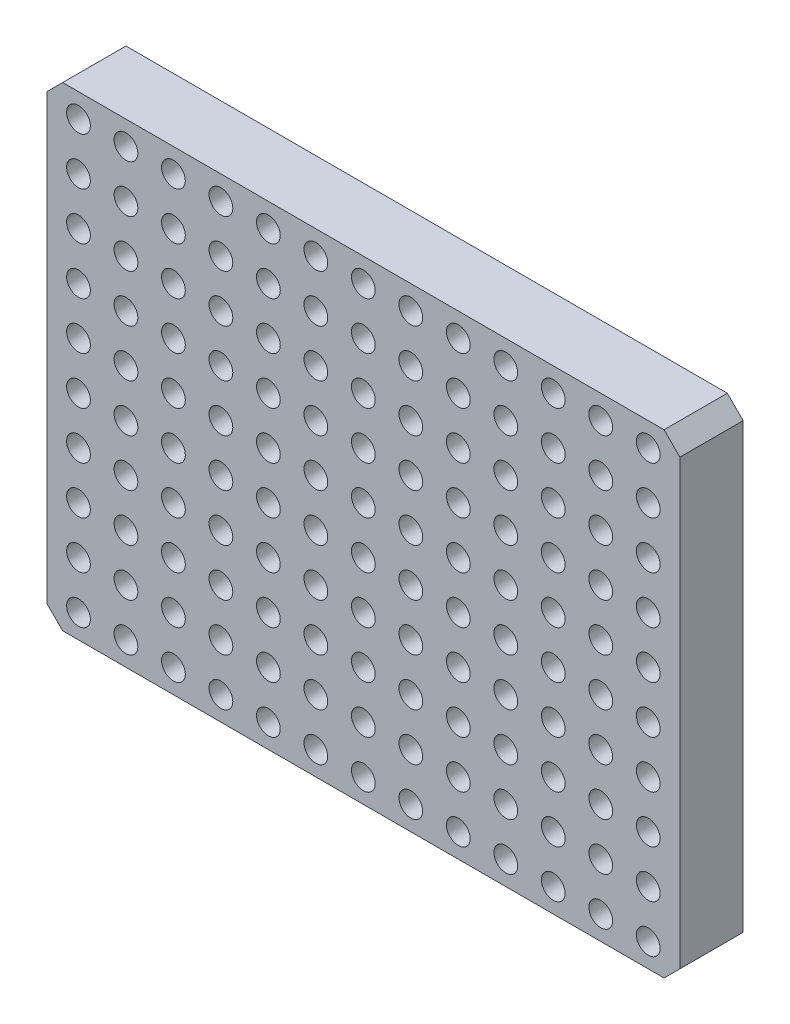
from build123d import *

# Parameters (mm, degrees)
SKETCH_1_W          = 400
SKETCH_1_H          = 300
EXTRUDE_1_DEPTH     = 40
SKETCH_2_R          = 7.5
CUT_EXTRUDE_1_DEPTH = 20
CHAMFER_1_SIZE      = 10


with BuildPart() as part:
    # 草图1 → 凸台-拉伸1 (new body)
    with BuildSketch(Plane.XY):
        Rectangle(SKETCH_1_W, SKETCH_1_H)
    extrude(amount=EXTRUDE_1_DEPTH)

    # 草图2 → 切除-拉伸1 (cut)
    with BuildSketch(Plane.XY.offset(40)):
        with Locations((-180, 135)):
            Circle(SKETCH_2_R)
        with Locations((-150, 135)):
            Circle(SKETCH_2_R)
        with Locations((-120, 135)):
            Circle(SKETCH_2_R)
        with Locations((-90, 135)):
            Circle(SKETCH_2_R)
        with Locations((-60, 135)):
            Circle(SKETCH_2_R)
        with Locations((-30, 135)):
            Circle(SKETCH_2_R)
        with Locations((0, 135)):
            Circle(SKETCH_2_R)
        with Locations((30, 135)):
            Circle(SKETCH_2_R)
        with Locations((60, 135)):
            Circle(SKETCH_2_R)
        with Locations((90, 135)):
            Circle(SKETCH_2_R)
        with Locations((120, 135)):
            Circle(SKETCH_2_R)
        with Locations((150, 135)):
            Circle(SKETCH_2_R)
        with Locations((180, 135)):
            Circle(SKETCH_2_R)
        with Locations((-150, 105)):
            Circle(SKETCH_2_R)
        with Locations((-120, 105)):
            Circle(SKETCH_2_R)
        with Locations((-90, 105)):
            Circle(SKETCH_2_R)
        with Locations((-60, 105)):
            Circle(SKETCH_2_R)
        with Locations((-30, 105)):
            Circle(SKETCH_2_R)
        with Locations((0, 105)):
            Circle(SKETCH_2_R)
        with Locations((30, 105)):
            Circle(SKETCH_2_R)
        with Locations((60, 105)):
            Circle(SKETCH_2_R)
        with Locations((90, 105)):
            Circle(SKETCH_2_R)
        with Locations((120, 105)):
            Circle(SKETCH_2_R)
        with Locations((150, 105)):
            Circle(SKETCH_2_R)
        with Locations((180, 105)):
            Circle(SKETCH_2_R)
        with Locations((-150, 75)):
            Circle(SKETCH_2_R)
        with Locations((-120, 75)):
            Circle(SKETCH_2_R)
        with Locations((-90, 75)):
            Circle(SKETCH_2_R)
        with Locations((-60, 75)):
            Circle(SKETCH_2_R)
        with Locations((-30, 75)):
            Circle(SKETCH_2_R)
        with Locations((0, 75)):
            Circle(SKETCH_2_R)
        with Locations((30, 75)):
            Circle(SKETCH_2_R)
        with Locations((60, 75)):
            Circle(SKETCH_2_R)
        with Locations((90, 75)):
            Circle(SKETCH_2_R)
        with Locations((120, 75)):
            Circle(SKETCH_2_R)
        with Locations((150, 75)):
            Circle(SKETCH_2_R)
        with Locations((180, 75)):
            Circle(SKETCH_2_R)
        with Locations((-150, 45)):
            Circle(SKETCH_2_R)
        with Locations((-120, 45)):
            Circle(SKETCH_2_R)
        with Locations((-90, 45)):
            Circle(SKETCH_2_R)
        with Locations((-60, 45)):
            Circle(SKETCH_2_R)
        with Locations((-30, 45)):
            Circle(SKETCH_2_R)
        with Locations((0, 45)):
            Circle(SKETCH_2_R)
        with Locations((30, 45)):
            Circle(SKETCH_2_R)
        with Locations((60, 45)):
            Circle(SKETCH_2_R)
        with Locations((90, 45)):
            Circle(SKETCH_2_R)
        with Locations((120, 45)):
            Circle(SKETCH_2_R)
        with Locations((150, 45)):
            Circle(SKETCH_2_R)
        with Locations((180, 45)):
            Circle(SKETCH_2_R)
        with Locations((-150, 15)):
            Circle(SKETCH_2_R)
        with Locations((-120, 15)):
            Circle(SKETCH_2_R)
        with Locations((-90, 15)):
            Circle(SKETCH_2_R)
        with Locations((-60, 15)):
            Circle(SKETCH_2_R)
        with Locations((-30, 15)):
            Circle(SKETCH_2_R)
        with Locations((0, 15)):
            Circle(SKETCH_2_R)
        with Locations((30, 15)):
            Circle(SKETCH_2_R)
        with Locations((60, 15)):
            Circle(SKETCH_2_R)
        with Locations((90, 15)):
            Circle(SKETCH_2_R)
        with Locations((120, 15)):
            Circle(SKETCH_2_R)
        with Locations((150, 15)):
            Circle(SKETCH_2_R)
        with Locations((180, 15)):
            Circle(SKETCH_2_R)
        with Locations((-150, -15)):
            Circle(SKETCH_2_R)
        with Locations((-120, -15)):
            Circle(SKETCH_2_R)
        with Locations((-90, -15)):
            Circle(SKETCH_2_R)
        with Locations((-60, -15)):
            Circle(SKETCH_2_R)
        with Locations((-30, -15)):
            Circle(SKETCH_2_R)
        with Locations((0, -15)):
            Circle(SKETCH_2_R)
        with Locations((30, -15)):
            Circle(SKETCH_2_R)
        with Locations((60, -15)):
            Circle(SKETCH_2_R)
        with Locations((90, -15)):
            Circle(SKETCH_2_R)
        with Locations((120, -15)):
            Circle(SKETCH_2_R)
        with Locations((150, -15)):
            Circle(SKETCH_2_R)
        with Locations((180, -15)):
            Circle(SKETCH_2_R)
        with Locations((-150, -45)):
            Circle(SKETCH_2_R)
        with Locations((-120, -45)):
            Circle(SKETCH_2_R)
        with Locations((-90, -45)):
            Circle(SKETCH_2_R)
        with Locations((-60, -45)):
            Circle(SKETCH_2_R)
        with Locations((-30, -45)):
            Circle(SKETCH_2_R)
        with Locations((0, -45)):
            Circle(SKETCH_2_R)
        with Locations((30, -45)):
            Circle(SKETCH_2_R)
        with Locations((60, -45)):
            Circle(SKETCH_2_R)
        with Locations((90, -45)):
            Circle(SKETCH_2_R)
        with Locations((120, -45)):
            Circle(SKETCH_2_R)
        with Locations((150, -45)):
            Circle(SKETCH_2_R)
        with Locations((180, -45)):
            Circle(SKETCH_2_R)
        with Locations((-150, -75)):
            Circle(SKETCH_2_R)
        with Locations((-120, -75)):
            Circle(SKETCH_2_R)
        with Locations((-90, -75)):
            Circle(SKETCH_2_R)
        with Locations((-60, -75)):
            Circle(SKETCH_2_R)
        with Locations((-30, -75)):
            Circle(SKETCH_2_R)
        with Locations((0, -75)):
            Circle(SKETCH_2_R)
        with Locations((30, -75)):
            Circle(SKETCH_2_R)
        with Locations((60, -75)):
            Circle(SKETCH_2_R)
        with Locations((90, -75)):
            Circle(SKETCH_2_R)
        with Locations((120, -75)):
            Circle(SKETCH_2_R)
        with Locations((150, -75)):
            Circle(SKETCH_2_R)
        with Locations((180, -75)):
            Circle(SKETCH_2_R)
        with Locations((-150, -105)):
            Circle(SKETCH_2_R)
        with Locations((-120, -105)):
            Circle(SKETCH_2_R)
        with Locations((-90, -105)):
            Circle(SKETCH_2_R)
        with Locations((-60, -105)):
            Circle(SKETCH_2_R)
        with Locations((-30, -105)):
            Circle(SKETCH_2_R)
        with Locations((0, -105)):
            Circle(SKETCH_2_R)
        with Locations((30, -105)):
            Circle(SKETCH_2_R)
        with Locations((60, -105)):
            Circle(SKETCH_2_R)
        with Locations((90, -105)):
            Circle(SKETCH_2_R)
        with Locations((120, -105)):
            Circle(SKETCH_2_R)
        with Locations((150, -105)):
            Circle(SKETCH_2_R)
        with Locations((180, -105)):
            Circle(SKETCH_2_R)
        with Locations((-150, -135)):
            Circle(SKETCH_2_R)
        with Locations((-120, -135)):
            Circle(SKETCH_2_R)
        with Locations((-90, -135)):
            Circle(SKETCH_2_R)
        with Locations((-60, -135)):
            Circle(SKETCH_2_R)
        with Locations((-30, -135)):
            Circle(SKETCH_2_R)
        with Locations((0, -135)):
            Circle(SKETCH_2_R)
        with Locations((30, -135)):
            Circle(SKETCH_2_R)
        with Locations((60, -135)):
            Circle(SKETCH_2_R)
        with Locations((90, -135)):
            Circle(SKETCH_2_R)
        with Locations((120, -135)):
            Circle(SKETCH_2_R)
        with Locations((150, -135)):
            Circle(SKETCH_2_R)
        with Locations((180, -135)):
            Circle(SKETCH_2_R)
        with Locations((-180, 105)):
            Circle(SKETCH_2_R)
        with Locations((-180, 75)):
            Circle(SKETCH_2_R)
        with Locations((-180, 45)):
            Circle(SKETCH_2_R)
        with Locations((-180, 15)):
            Circle(SKETCH_2_R)
        with Locations((-180, -15)):
            Circle(SKETCH_2_R)
        with Locations((-180, -45)):
            Circle(SKETCH_2_R)
        with Locations((-180, -75)):
            Circle(SKETCH_2_R)
        with Locations((-180, -105)):
            Circle(SKETCH_2_R)
        with Locations((-180, -135)):
            Circle(SKETCH_2_R)
    extrude(amount=-CUT_EXTRUDE_1_DEPTH, mode=Mode.SUBTRACT)

    # 倒角1
    chamfer_1_edges = [part.edges().sort_by_distance(p)[0] for p in [
        (200, -150, 20),
        (-200, -150, 20),
        (-200, 150, 20),
        (200, 150, 20),
    ]]
    chamfer(chamfer_1_edges, length=CHAMFER_1_SIZE)


solid = part.part
